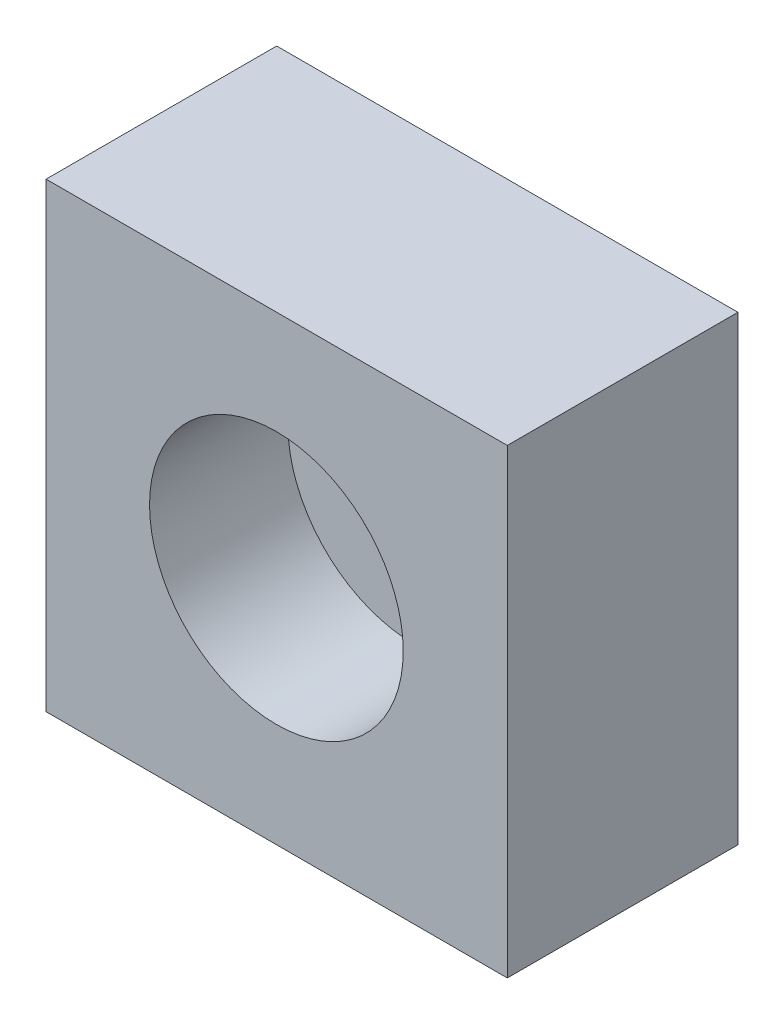
from build123d import *

# Parameters (mm, degrees)
SKETCH_1_W                                = 20
SKETCH_1_H                                = 20
BASEBOX_DEPTH                             = 10
HOLE_CB_ANSI_METRIC_SOCKET_M6_D           = 6
HOLE_CB_ANSI_METRIC_SOCKET_M6_CBORE_D     = 11
HOLE_CB_ANSI_METRIC_SOCKET_M6_CBORE_DEPTH = 6


with BuildPart() as part:
    # 草图1 → BaseBox (new body)
    with BuildSketch(Plane.XY):
        with Locations((10, 10)):
            Rectangle(SKETCH_1_W, SKETCH_1_H)
    extrude(amount=BASEBOX_DEPTH)

    # Hole_cb_ansi_metric_socket_m6 (through all)
    with Locations(Plane.XY.offset(10)):
        with Locations((9.986487375, 10.014305599)):
            CounterBoreHole(HOLE_CB_ANSI_METRIC_SOCKET_M6_D / 2, HOLE_CB_ANSI_METRIC_SOCKET_M6_CBORE_D / 2, HOLE_CB_ANSI_METRIC_SOCKET_M6_CBORE_DEPTH)


solid = part.part
